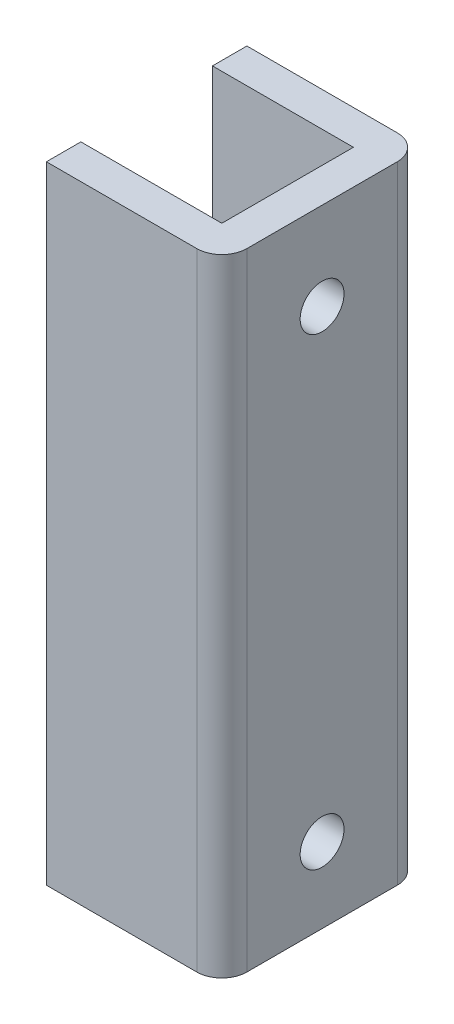
from build123d import *

# Parameters (mm, degrees)
EXTRUDE_1_DEPTH     = 50
SKETCH_2_W          = 8.5
SKETCH_2_H          = 10.5
CUT_EXTRUDE_1_DEPTH = 52.870829554
SKETCH_3_W          = 2.75
SKETCH_3_H          = 10.5
CUT_EXTRUDE_2_DEPTH = 52.870829554
SKETCH_4_R          = 1.75
CUT_EXTRUDE_3_DEPTH = 53.975575482


with BuildPart() as part:
    # 草图1 → 凸台-拉伸1 (new body)
    with BuildSketch(Plane(origin=(0, 0, 0), x_dir=(1, 0, 0), z_dir=(0, 1, 0))):
        with BuildLine():
            Line((-8.953846154, 10.507692308), (-8.953846154, -5.492307692))
            Line((-8.953846154, -5.492307692), (3.046153846, -5.492307692))
            ThreePointArc((3.046153846, -5.492307692), (4.460367409, -4.906521255), (5.046153846, -3.492307692))
            Line((5.046153846, -3.492307692), (5.046153846, 8.507692308))
            ThreePointArc((5.046153846, 8.507692308), (4.460367409, 9.92190587), (3.046153846, 10.507692308))
            Line((3.046153846, 10.507692308), (-8.953846154, 10.507692308))
        make_face()
    extrude(amount=EXTRUDE_1_DEPTH)

    # 草图2 → 切除-拉伸1 (cut, through all)
    with BuildSketch(Plane(origin=(0, 50, 0), x_dir=(1, 0, 0), z_dir=(0, 1, 0))):
        with Locations((-1.953846154, 2.507692308)):
            Rectangle(SKETCH_2_W, SKETCH_2_H)
    extrude(amount=-CUT_EXTRUDE_1_DEPTH, mode=Mode.SUBTRACT)

    # 草图3 → 切除-拉伸2 (cut, through all)
    with BuildSketch(Plane(origin=(0, 50, 0), x_dir=(1, 0, 0), z_dir=(0, 1, 0))):
        with Locations((-7.578846154, 2.507692308)):
            Rectangle(SKETCH_3_W, SKETCH_3_H)
    extrude(amount=-CUT_EXTRUDE_2_DEPTH, mode=Mode.SUBTRACT)

    # 草图4 → 切除-拉伸3 (cut, through all)
    with BuildSketch(Plane(origin=(5.046153846, 0, 0), x_dir=(0, 0, -1), z_dir=(1, 0, 0))):
        with Locations((2.507692308, 43)):
            Circle(SKETCH_4_R)
        with Locations((2.507692308, 6)):
            Circle(SKETCH_4_R)
    extrude(amount=-CUT_EXTRUDE_3_DEPTH, mode=Mode.SUBTRACT)


solid = part.part
